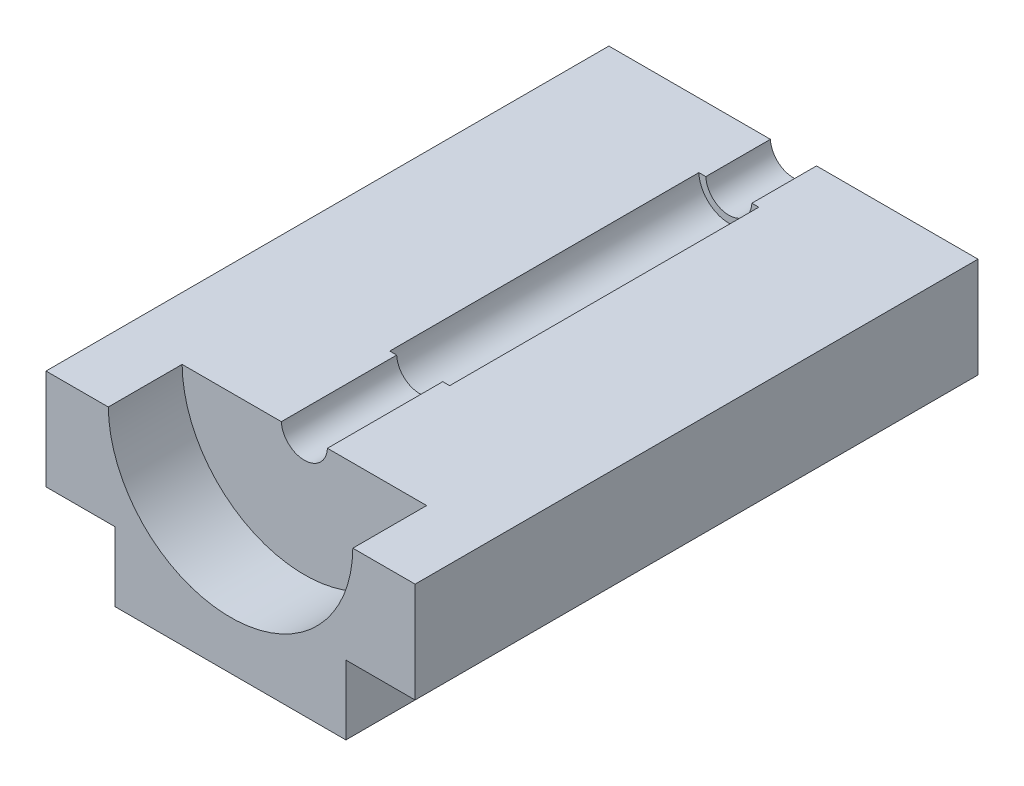
from build123d import *

# Parameters (mm, degrees)
BOSS_EXTRUDE1_DEPTH     = 8
SKETCH3_R               = 13.75
CUT_EXTRUDE1_DEPTH      = 8
SKETCH4_W               = 80
SKETCH4_H               = 37
BOSS_EXTRUDE2_DEPTH     = 122
SKETCH5_R               = 26.5
CUT_EXTRUDE2_DEPTH      = 16
SKETCH6_R               = 6.5
CUT_EXTRUDE3_DEPTH      = 122
BOSS_EXTRUDE3_START     = 16
BOSS_EXTRUDE3_DEPTH     = 25
BOSS_EXTRUDE4_START     = 108
BOSS_EXTRUDE4_DEPTH     = 14
SKETCH10_W              = 150
SKETCH10_H              = 175
CUT_EXTRUDE4_DEPTH      = 8
CUT_EXTRUDE5_DEPTH      = 141.474196919
CUT_EXTRUDE5_DEPTH_BACK = 141.474196919
SKETCH12_W              = 80
SKETCH12_H              = 0.25
SKETCH13_W              = 15
SKETCH13_H              = 15
CUT_EXTRUDE6_DEPTH      = 122


with BuildPart() as part:
    # Sketch2 → Boss-Extrude1 (new body)
    with BuildSketch(Plane.XY):
        with BuildLine():
            Line((-35, 60), (-35, 50))
            ThreePointArc((-35, 50), (-37.196699141, 44.696699141), (-42.5, 42.5))
            Line((-42.5, 42.5), (-52.5, 42.5))
            ThreePointArc((-52.5, 42.5), (-57.803300859, 40.303300859), (-60, 35))
            Line((-60, 35), (-60, -60))
            ThreePointArc((-60, -60), (-57.803300859, -65.303300859), (-52.5, -67.5))
            Line((-52.5, -67.5), (52.5, -67.5))
            ThreePointArc((52.5, -67.5), (57.803300859, -65.303300859), (60, -60))
            Line((60, -60), (60, 35))
            ThreePointArc((60, 35), (57.803300859, 40.303300859), (52.5, 42.5))
            Line((52.5, 42.5), (42.5, 42.5))
            ThreePointArc((42.5, 42.5), (37.196699141, 44.696699141), (35, 50))
            Line((35, 50), (35, 60))
            ThreePointArc((35, 60), (32.803300859, 65.303300859), (27.5, 67.5))
            Line((27.5, 67.5), (-27.5, 67.5))
            ThreePointArc((-27.5, 67.5), (-32.803300859, 65.303300859), (-35, 60))
        make_face()
    extrude(amount=-BOSS_EXTRUDE1_DEPTH)

    # Sketch3 → Cut-Extrude1 (cut)
    with BuildSketch(Plane.XY):
        with Locations((0, -20)):
            Circle(SKETCH3_R)
    extrude(amount=-CUT_EXTRUDE1_DEPTH, mode=Mode.SUBTRACT)

    # Sketch4 → Boss-Extrude2 (add)
    with BuildSketch(Plane(origin=(0, 0, -8), x_dir=(-1, 0, 0), z_dir=(0, 0, -1))):
        with Locations((0, -38.5)):
            Rectangle(SKETCH4_W, SKETCH4_H)
    extrude(amount=BOSS_EXTRUDE2_DEPTH)

    # Sketch5 → Cut-Extrude2 (cut)
    with BuildSketch(Plane(origin=(0, 0, -8), x_dir=(-1, 0, 0), z_dir=(0, 0, -1))):
        with Locations((0, -20)):
            Circle(SKETCH5_R)
    extrude(amount=CUT_EXTRUDE2_DEPTH, mode=Mode.SUBTRACT)

    # Sketch6 → Cut-Extrude3 (cut)
    with BuildSketch(Plane(origin=(0, 0, -8), x_dir=(-1, 0, 0), z_dir=(0, 0, -1))):
        with Locations((0, -20)):
            Circle(SKETCH6_R)
    extrude(amount=CUT_EXTRUDE3_DEPTH, mode=Mode.SUBTRACT)

    # Sketch8 → Boss-Extrude3 (add)
    with BuildSketch(Plane(origin=(0, 0, -8), x_dir=(-1, 0, 0), z_dir=(0, 0, -1)).offset(BOSS_EXTRUDE3_START)):
        with BuildLine():
            Line((-6.5, -20), (-5, -20))
            ThreePointArc((-5, -20), (0, -25), (5, -20))
            Line((5, -20), (6.5, -20))
            ThreePointArc((6.5, -20), (0, -26.5), (-6.5, -20))
        make_face()
    extrude(amount=BOSS_EXTRUDE3_DEPTH)

    # Sketch9 → Boss-Extrude4 (add)
    with BuildSketch(Plane(origin=(0, 0, -8), x_dir=(-1, 0, 0), z_dir=(0, 0, -1)).offset(BOSS_EXTRUDE4_START)):
        with BuildLine():
            Line((-6.5, -20), (-5, -20))
            ThreePointArc((-5, -20), (0, -25), (5, -20))
            Line((5, -20), (6.5, -20))
            ThreePointArc((6.5, -20), (0, -26.5), (-6.5, -20))
        make_face()
    extrude(amount=BOSS_EXTRUDE4_DEPTH)

    # Sketch10 → Cut-Extrude4 (cut)
    with BuildSketch(Plane.XY):
        Rectangle(SKETCH10_W, SKETCH10_H)
    extrude(amount=-CUT_EXTRUDE4_DEPTH, mode=Mode.SUBTRACT)

    # Sketch12 → Cut-Extrude5 (cut, two sides: drawn at the far end of the back side and taken through both)
    with BuildSketch(Plane.XY.offset(-8).offset(-CUT_EXTRUDE5_DEPTH_BACK)):
        with Locations((0, -20.125)):
            Rectangle(SKETCH12_W, SKETCH12_H)
    extrude(amount=CUT_EXTRUDE5_DEPTH + CUT_EXTRUDE5_DEPTH_BACK, mode=Mode.SUBTRACT)

    # Sketch13 → Cut-Extrude6 (cut)
    with BuildSketch(Plane(origin=(0, 0, -130), x_dir=(-1, 0, 0), z_dir=(0, 0, -1))):
        with Locations((32.5, -49.5)):
            Rectangle(SKETCH13_W, SKETCH13_H)
        with Locations((-32.5, -49.5)):
            Rectangle(SKETCH13_W, SKETCH13_H)
    extrude(amount=-CUT_EXTRUDE6_DEPTH, mode=Mode.SUBTRACT)


solid = part.part
